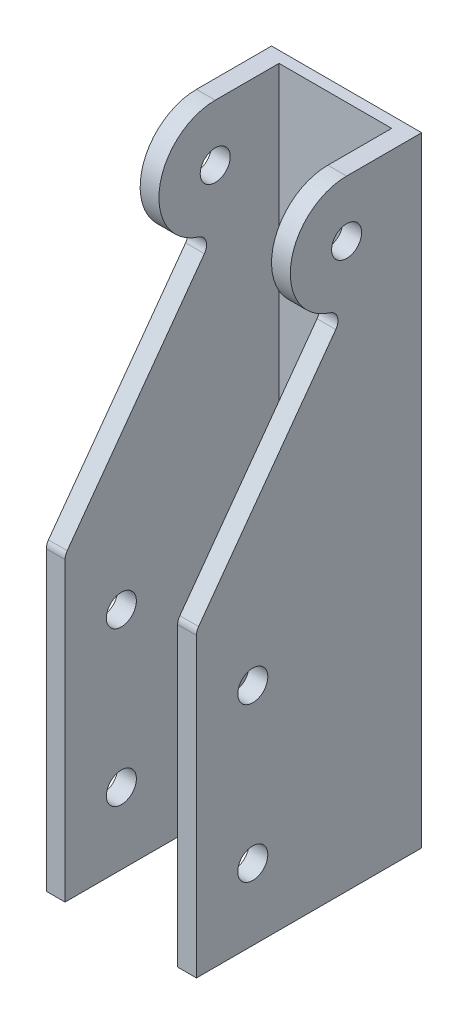
from build123d import *

# Parameters (mm, degrees)
SKETCH1_W           = 200
SKETCH1_H           = 40
BOSS_EXTRUDE1_DEPTH = 3
SKETCH2_W           = 5
SKETCH2_H           = 200
BOSS_EXTRUDE2_DEPTH = 60
SKETCH4_R           = 4
CUT_EXTRUDE1_DEPTH  = 60
FILLET2_R           = 3


with BuildPart() as part:
    # Sketch1 → Boss-Extrude1 (new body)
    with BuildSketch(Plane(origin=(0, 0, 0), x_dir=(0, 1, 0), z_dir=(0, 0, 1))):
        Rectangle(SKETCH1_W, SKETCH1_H)
    extrude(amount=BOSS_EXTRUDE1_DEPTH)

    # Sketch2 → Boss-Extrude2 (add)
    with BuildSketch(Plane.XY.offset(3)):
        with Locations((-17.5, 0)):
            Rectangle(SKETCH2_W, SKETCH2_H)
        with Locations((17.5, 0)):
            Rectangle(SKETCH2_W, SKETCH2_H)
    extrude(amount=BOSS_EXTRUDE2_DEPTH)

    # Sketch4 → Cut-Extrude1 (cut)
    with BuildSketch(Plane(origin=(-20, 0, 0), x_dir=(0, -1, 0), z_dir=(-1, 0, 0))):
        with BuildLine():
            Line((-100, 63), (-100, 20))
            ThreePointArc((-100, 20), (-85, 35), (-70, 20))
            Line((-70, 20), (-15, 60))
            Line((-15, 60), (65, 60))
            Line((65, 60), (65, 0))
            Line((65, 0), (100, 0))
            Line((100, 0), (100, 63))
            Line((100, 63), (-100, 63))
        make_face()
        with Locations(Location((-85, 20, 0), (0, 0, 90))):
            Circle(SKETCH4_R)
        with Locations(Location((5, 45, 0), (0, 0, 90))):
            Circle(SKETCH4_R)
        with Locations(Location((46, 45, 0), (0, 0, 90))):
            Circle(SKETCH4_R)
    extrude(amount=-CUT_EXTRUDE1_DEPTH, mode=Mode.SUBTRACT)

    # Fillet2
    fillet2_edges = [part.edges().sort_by_distance(p)[0] for p in [
        (17.5, 70, 20),
        (-17.5, 70, 20),
        (17.5, 15, 60),
        (-17.5, 15, 60),
    ]]
    fillet(fillet2_edges, radius=FILLET2_R)


solid = part.part
